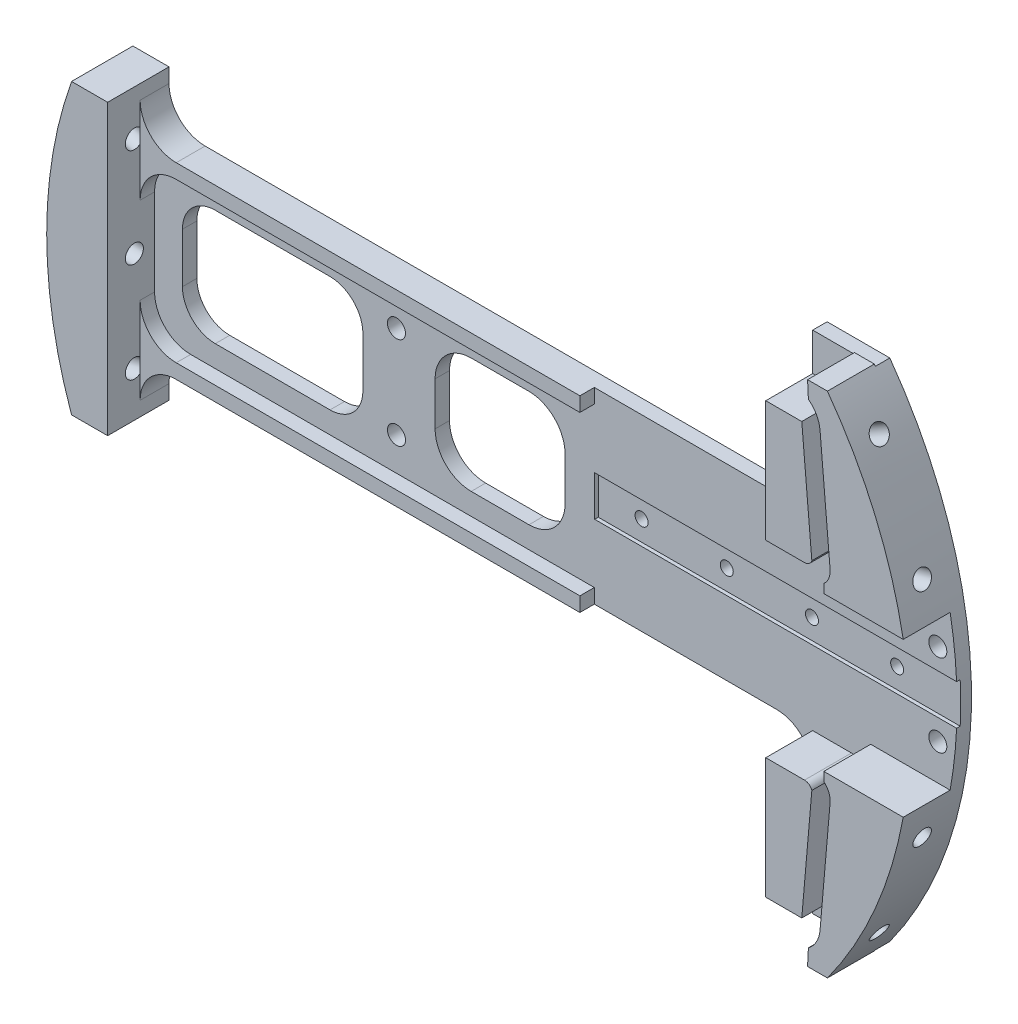
from build123d import *

# Parameters (mm, degrees)
SKETCH1_R           = 1.5875
BOSS_EXTRUDE1_DEPTH = 2.54
BOSS_EXTRUDE2_DEPTH = 8.255
SKETCH3_W           = 64.77
SKETCH3_H           = 7.1
CUT_EXTRUDE1_DEPTH  = 0.635
SKETCH9_R           = 1.5875
CUT_EXTRUDE4_DEPTH  = 89.512075769
SKETCH4_R           = 1.143
CUT_EXTRUDE2_DEPTH  = 11.43
BOSS_EXTRUDE5_DEPTH = 8.255
SKETCH28_R          = 1.5875
CUT_EXTRUDE12_DEPTH = 7.62
SKETCH29_R          = 1.5875
CUT_EXTRUDE13_DEPTH = 10.16
CUT_EXTRUDE14_START = -12.7
SKETCH30_R          = 1.5875
CUT_EXTRUDE14_DEPTH = 12.7
SKETCH31_R          = 1.5875
CUT_EXTRUDE15_DEPTH = 12.7
CUT_EXTRUDE16_START = -12.7
SKETCH32_R          = 1.5875
CUT_EXTRUDE16_DEPTH = 12.7
BOSS_EXTRUDE6_DEPTH = 2.54
CUT_EXTRUDE17_DEPTH = 89.512075921


with BuildPart() as part:
    # Sketch1 → Boss-Extrude1 (new body)
    with BuildSketch(Plane.XY):
        with BuildLine():
            Line((-71.572584947, 25.4), (-65.222584947, 25.4))
            Line((-65.222584947, 25.4), (-65.222584947, 22.86))
            ThreePointArc((-65.222584947, 22.86), (-63.362713008, 18.369871939), (-58.872584947, 16.51))
            Line((-58.872584947, 16.51), (44.196, 16.51))
            ThreePointArc((44.196, 16.51), (48.686128061, 18.369871939), (50.546, 22.86))
            Line((50.546, 22.86), (50.546, 44.45))
            Line((50.546, 44.45), (61.579155694, 44.45))
            ThreePointArc((61.579155694, 44.45), (75.946, 0), (61.579155694, -44.45))
            Line((61.579155694, -44.45), (50.546, -44.45))
            Line((50.546, -44.45), (50.546, -22.86))
            ThreePointArc((50.546, -22.86), (48.686128061, -18.369871939), (44.196, -16.51))
            Line((44.196, -16.51), (-58.872584947, -16.51))
            ThreePointArc((-58.872584947, -16.51), (-63.362713008, -18.369871939), (-65.222584947, -22.86))
            Line((-65.222584947, -22.86), (-65.222584947, -25.4))
            Line((-65.222584947, -25.4), (-71.572584947, -25.4))
            ThreePointArc((-71.572584947, -25.4), (-75.946, 0), (-71.572584947, 25.4))
        make_face()
        with Locations((-22.6695, 8.128)):
            Circle(SKETCH1_R, mode=Mode.SUBTRACT)
        with Locations((-22.6695, -8.128)):
            Circle(SKETCH1_R, mode=Mode.SUBTRACT)
    extrude(amount=BOSS_EXTRUDE1_DEPTH)

    # Sketch2 → Boss-Extrude2 (add)
    with BuildSketch(Plane.XY.offset(2.54)):
        with BuildLine():
            Line((61.865268471, 17.78), (60.095110466, 38.1))
            ThreePointArc((60.095110466, 38.1), (59.464196764, 40.158289632), (58.047089349, 41.778911391))
            Line((58.047089349, 41.778911391), (57.900800643, 44.704))
            Line((57.900800643, 44.704), (61.395010384, 44.704))
            ThreePointArc((61.395010384, 44.704), (69.822038137, 29.877715884), (74.728381149, 13.544887112))
            Line((74.728381149, 13.544887112), (60.759450402, 13.544887112))
            Line((60.759450402, 13.544887112), (60.759450402, 15.094127876))
            ThreePointArc((60.759450402, 15.094127876), (61.639191639, 16.302501703), (61.865268471, 17.78))
        make_face()
        with BuildLine():
            Line((58.651639318, 17.500047669), (56.881481313, 37.820047669))
            Line((56.881481313, 37.820047669), (50.546, 37.820047669))
            Line((50.546, 37.820047669), (50.546, 16.566735288))
            Line((50.546, 16.566735288), (57.366094516, 16.566735288))
            ThreePointArc((57.366094516, 16.566735288), (58.160401987, 16.824667019), (58.651639318, 17.500047669))
        make_face()
        with BuildLine():
            Line((60.759450402, -13.544887112), (74.728381149, -13.544887112))
            ThreePointArc((74.728381149, -13.544887112), (69.822038137, -29.877715884), (61.395010384, -44.704))
            Line((61.395010384, -44.704), (57.900800643, -44.704))
            Line((57.900800643, -44.704), (58.047089349, -41.778911391))
            ThreePointArc((58.047089349, -41.778911391), (59.464196764, -40.158289632), (60.095110466, -38.1))
            Line((60.095110466, -38.1), (61.865268471, -17.78))
            ThreePointArc((61.865268471, -17.78), (61.639191639, -16.302501703), (60.759450402, -15.094127876))
            Line((60.759450402, -15.094127876), (60.759450402, -13.544887112))
        make_face()
        with BuildLine():
            Line((50.546, -16.566735288), (57.366094516, -16.566735288))
            ThreePointArc((57.366094516, -16.566735288), (58.160401987, -16.824667019), (58.651639318, -17.500047669))
            Line((58.651639318, -17.500047669), (56.881481313, -37.820047669))
            Line((56.881481313, -37.820047669), (50.546, -37.820047669))
            Line((50.546, -37.820047669), (50.546, -16.566735288))
        make_face()
    extrude(amount=BOSS_EXTRUDE2_DEPTH)

    # Sketch3 → Cut-Extrude1 (cut)
    with BuildSketch(Plane.XY.offset(2.54)):
        with Locations((44.577, 0)):
            Rectangle(SKETCH3_W, SKETCH3_H)
    extrude(amount=-CUT_EXTRUDE1_DEPTH, mode=Mode.SUBTRACT)

    # Sketch9 → Cut-Extrude4 (cut, through all)
    with BuildSketch(Plane.XY.offset(2.54)):
        with Locations((72.560984492, -7.239)):
            Circle(SKETCH9_R)
        with Locations((72.560984492, 7.239)):
            Circle(SKETCH9_R)
    extrude(amount=-CUT_EXTRUDE4_DEPTH, mode=Mode.SUBTRACT)

    # Sketch4 → Cut-Extrude2 (cut)
    with BuildSketch(Plane.XY.offset(1.905)):
        with Locations((19.812, 0)):
            Circle(SKETCH4_R)
        with Locations((34.798, 0)):
            Circle(SKETCH4_R)
        with Locations((49.784, 0)):
            Circle(SKETCH4_R)
        with Locations((64.77, 0)):
            Circle(SKETCH4_R)
    extrude(amount=-CUT_EXTRUDE2_DEPTH, mode=Mode.SUBTRACT)

    # Sketch19 → Boss-Extrude5 (add)
    with BuildSketch(Plane.XY.offset(2.54)):
        with BuildLine():
            Line((-71.572584947, -25.4), (-65.222584947, -25.4))
            Line((-65.222584947, -25.4), (-65.222584947, 25.4))
            Line((-65.222584947, 25.4), (-71.572584947, 25.4))
            ThreePointArc((-71.572584947, 25.4), (-75.946, 0), (-71.572584947, -25.4))
        make_face()
    extrude(amount=BOSS_EXTRUDE5_DEPTH)

    # Sketch28 → Cut-Extrude12 (cut)
    with BuildSketch(Plane(origin=(65.771165316, 37.973, 0), x_dir=(0, 0, -1), z_dir=(0.8660254037844379, 0.5000000000000011, 0))):
        with Locations(Location((-6.053310192, 0, 0), (0, 0, 90))):
            Circle(SKETCH28_R)
    cut_extrude12 = extrude(amount=-CUT_EXTRUDE12_DEPTH, mode=Mode.SUBTRACT)

    # Sketch29 → Cut-Extrude13 (cut)
    with BuildSketch(Plane(origin=(73.358202803, 19.656271199, 0), x_dir=(0, 0, -1), z_dir=(0.9659258262890682, 0.25881904510252135, 0))):
        with Locations(Location((-6.096, 0, 0), (0, 0, 90))):
            Circle(SKETCH29_R)
    cut_extrude13 = extrude(amount=-CUT_EXTRUDE13_DEPTH, mode=Mode.SUBTRACT)

    # Mirror3: Cut-Extrude12, Cut-Extrude13 across plane
    add(cut_extrude12.mirror(Plane.ZX), mode=Mode.SUBTRACT)
    add(cut_extrude13.mirror(Plane.ZX), mode=Mode.SUBTRACT)

    # Sketch30 → Cut-Extrude14 (cut)
    with BuildSketch(Plane(origin=(-73.358202803, 19.656271199, 0), x_dir=(0, 0, 1), z_dir=(-0.9659258262890681, 0.2588190451025213, 0)).offset(CUT_EXTRUDE14_START)):
        with Locations(Location((6.096, 0, 0), (0, 0, 90))):
            Circle(SKETCH30_R)
    extrude(amount=CUT_EXTRUDE14_DEPTH, mode=Mode.SUBTRACT)

    # Sketch31 → Cut-Extrude15 (cut)
    with BuildSketch(Plane.ZY.offset(75.946)):
        with Locations((6.096, 0)):
            Circle(SKETCH31_R)
    extrude(amount=-CUT_EXTRUDE15_DEPTH, mode=Mode.SUBTRACT)

    # Sketch32 → Cut-Extrude16 (cut)
    with BuildSketch(Plane(origin=(-73.358202803, -19.656271199, 0), x_dir=(0, 0, 1), z_dir=(-0.9659258262890681, -0.2588190451025213, 0)).offset(CUT_EXTRUDE16_START)):
        with Locations(Location((6.096, 0, 0), (0, 0, 90))):
            Circle(SKETCH32_R)
    extrude(amount=CUT_EXTRUDE16_DEPTH, mode=Mode.SUBTRACT)

    # Sketch33 → Boss-Extrude6 (add)
    with BuildSketch(Plane.XY.offset(2.54)):
        with BuildLine():
            Line((12.137284041, 16.51), (-58.872584947, 16.51))
            ThreePointArc((-58.872584947, 16.51), (-63.362713008, 18.369871939), (-65.222584947, 22.86))
            Line((-65.222584947, 22.86), (-65.222584947, 7.62))
            ThreePointArc((-65.222584947, 7.62), (-63.362713008, 12.110128061), (-58.872584947, 13.97))
            Line((-58.872584947, 13.97), (12.137284041, 13.97))
            Line((12.137284041, 13.97), (12.137284041, 16.51))
        make_face()
        with BuildLine():
            Line((12.137284041, -13.97), (12.137284041, -16.51))
            Line((12.137284041, -16.51), (-58.872584947, -16.51))
            ThreePointArc((-58.872584947, -16.51), (-63.362713008, -18.369871939), (-65.222584947, -22.86))
            Line((-65.222584947, -22.86), (-65.222584947, -7.62))
            ThreePointArc((-65.222584947, -7.62), (-63.362713008, -12.110128061), (-58.872584947, -13.97))
            Line((-58.872584947, -13.97), (12.137284041, -13.97))
        make_face()
    extrude(amount=BOSS_EXTRUDE6_DEPTH)

    # Sketch34 → Cut-Extrude17 (cut, through all)
    with BuildSketch(Plane.XY.offset(2.54)):
        with BuildLine():
            Line((-54.541546126, -10.16), (-34.358453874, -10.16))
            ThreePointArc((-34.358453874, -10.16), (-30.268934421, -8.466065579), (-28.575, -4.376546126))
            Line((-28.575, -4.376546126), (-28.575, 4.376546126))
            ThreePointArc((-28.575, 4.376546126), (-30.268934421, 8.466065579), (-34.358453874, 10.16))
            Line((-34.358453874, 10.16), (-54.541546126, 10.16))
            ThreePointArc((-54.541546126, 10.16), (-58.631065579, 8.466065579), (-60.325, 4.376546126))
            Line((-60.325, 4.376546126), (-60.325, -4.376546126))
            ThreePointArc((-60.325, -4.376546126), (-58.631065579, -8.466065579), (-54.541546126, -10.16))
        make_face()
        with BuildLine():
            Line((-9.525, 10.16), (0.635, 10.16))
            ThreePointArc((0.635, 10.16), (5.125128061, 8.300128061), (6.985, 3.81))
            Line((6.985, 3.81), (6.985, -3.81))
            ThreePointArc((6.985, -3.81), (5.125128061, -8.300128061), (0.635, -10.16))
            Line((0.635, -10.16), (-9.525, -10.16))
            ThreePointArc((-9.525, -10.16), (-14.015128061, -8.300128061), (-15.875, -3.81))
            Line((-15.875, -3.81), (-15.875, 3.81))
            ThreePointArc((-15.875, 3.81), (-14.015128061, 8.300128061), (-9.525, 10.16))
        make_face()
    extrude(amount=-CUT_EXTRUDE17_DEPTH, mode=Mode.SUBTRACT)


solid = part.part
